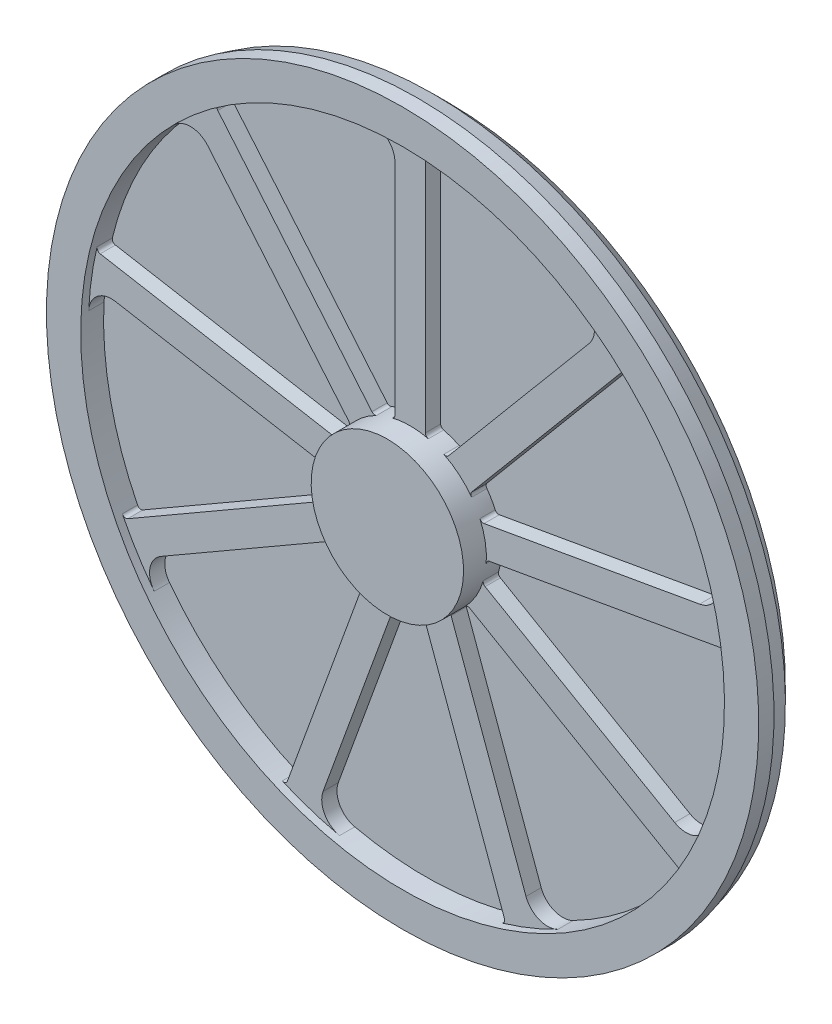
from build123d import *

# Parameters (mm, degrees)
BOSS_EXTRUDE2_DEPTH = 20


with BuildPart() as part:
    # Sketch1 → Revolve2 (revolve)
    with BuildSketch(Plane(origin=(0, 0, 0), x_dir=(0, 0, -1), z_dir=(1, 0, 0))):
        Polygon((-50, 0), (-50, 100), (0, 100), (0, 422.5), (-30, 422.5), (-30, 467.5), (-10, 467.5), (10.490381057, 462.009618943), (30, 442.5), (30, 0), align=None)
    revolve(axis=Axis((0, 0, -30), (0, 0, 1)))

    # Sketch2 → Boss-Extrude2 (add)
    with BuildSketch(Plane.XY):
        with BuildLine():
            ThreePointArc((20, 416.750824834), (21.571954346, 420.390674143), (25.299401198, 421.741852677))
            ThreePointArc((25.299401198, 421.741852677), (-14.324130925, 422.257112756), (-53.821656051, 419.057847248))
            ThreePointArc((-53.821656051, 419.057847248), (-30.183967117, 411.826133147), (-20, 389.302260461))
            Line((-20, 389.302260461), (-20, 101.980390272))
            ThreePointArc((-20, 101.980390272), (-21.066021038, 98.894323273), (-23.80952381, 97.124181211))
            ThreePointArc((-23.80952381, 97.124181211), (-7.6e-08, 100), (23.809523662, 97.124181247))
            ThreePointArc((23.809523662, 97.124181247), (21.066020991, 98.894323332), (20, 101.980390272))
            Line((20, 101.980390272), (20, 416.750824834))
        make_face()
        with BuildLine():
            Line((80.87262016, 65.265759081), (283.203155392, 306.393901336))
            ThreePointArc((283.203155392, 306.393901336), (286.746992321, 308.171754896), (290.470903088, 306.810861051))
            ThreePointArc((290.470903088, 306.810861051), (260.448719284, 332.675088673), (228.135411415, 355.612828872))
            ThreePointArc((228.135411415, 355.612828872), (241.594475451, 334.879000902), (234.917780585, 311.078585513))
            Line((234.917780585, 311.078585513), (50.230842435, 90.977263469))
            ThreePointArc((50.230842435, 90.977263469), (47.430537313, 89.298424107), (44.191066876, 89.705906207))
            ThreePointArc((44.191066876, 89.705906207), (64.278760914, 76.604444358), (80.669373607, 59.096972527))
            ThreePointArc((80.669373607, 59.096972527), (79.705554025, 62.216469562), (80.87262016, 65.265759081))
        make_face()
        with BuildLine():
            ThreePointArc((419.7278412, 48.319657717), (413.354719175, 87.430693327), (403.345384438, 125.772615671))
            ThreePointArc((403.345384438, 125.772615671), (400.328177931, 101.23826237), (379.914920814, 87.297783151))
            Line((379.914920814, 87.297783151), (96.958115442, 37.404863989))
            ThreePointArc((96.958115442, 37.404863989), (93.733820124, 37.918799861), (91.514166241, 40.313240718))
            ThreePointArc((91.514166241, 40.313240718), (97.855548193, 20.598341874), (100, 0))
            ThreePointArc((100, 0), (99.945767062, -3.292969231), (99.783127073, -6.582366715))
            ThreePointArc((99.783127073, -6.582366715), (101.049972403, -3.57316188), (103.904042548, -1.987446132))
            Line((103.904042548, -1.987446132), (413.892406924, 52.671866213))
            ThreePointArc((413.892406924, 52.671866213), (417.749925751, 51.755846586), (419.7278412, 48.319657717))
        make_face()
        with BuildLine():
            ThreePointArc((-252.561377668, 332.105405723), (-253.696840813, 335.904124837), (-251.709971685, 339.335144296))
            ThreePointArc((-251.709971685, 339.335144296), (-282.39456108, 314.260340916), (-310.59497249, 286.421041587))
            ThreePointArc((-310.59497249, 286.421041587), (-287.838996013, 296.075240754), (-265.55955831, 285.367081126))
            Line((-265.55955831, 285.367081126), (-80.87262016, 65.265759081))
            ThreePointArc((-80.87262016, 65.265759081), (-79.705554022, 62.216469491), (-80.669373691, 59.096972412))
            ThreePointArc((-80.669373691, 59.096972412), (-64.27876097, 76.604444311), (-44.191066878, 89.705906206))
            ThreePointArc((-44.191066878, 89.705906206), (-47.430537315, 89.298424108), (-50.230842435, 90.977263469))
            Line((-50.230842435, 90.977263469), (-252.561377668, 332.105405723))
        make_face()
        with BuildLine():
            ThreePointArc((-406.946479818, 92.064176334), (-410.25806463, 94.244302361), (-410.941451372, 98.149750609))
            ThreePointArc((-410.941451372, 98.149750609), (-418.329437639, 59.217662947), (-422.037449422, 19.764647353))
            ThreePointArc((-422.037449422, 19.764647353), (-410.8109597, 41.787452703), (-386.86084792, 47.90547303))
            Line((-386.86084792, 47.90547303), (-103.904042548, -1.987446132))
            ThreePointArc((-103.904042548, -1.987446132), (-101.049972452, -3.573161825), (-99.783127082, -6.582366568))
            ThreePointArc((-99.783127082, -6.582366568), (-98.480775309, 17.364817721), (-91.514166278, 40.313240634))
            ThreePointArc((-91.514166278, 40.313240634), (-93.733820164, 37.918799839), (-96.958115442, 37.404863989))
            Line((-96.958115442, 37.404863989), (-406.946479818, 92.064176334))
        make_face()
        with BuildLine():
            ThreePointArc((-370.916801355, -191.054904341), (-374.854980495, -191.513476599), (-377.888858856, -188.961002201))
            ThreePointArc((-377.888858856, -188.961002201), (-358.523321113, -223.533617647), (-336.003913346, -256.139845038))
            ThreePointArc((-336.003913346, -256.139845038), (-341.559909689, -232.053148883), (-327.14564731, -211.971638306))
            Line((-327.14564731, -211.971638306), (-78.317608663, -68.310703212))
            ThreePointArc((-78.317608663, -68.310703212), (-75.111985725, -67.690871012), (-72.207246346, -69.181743077))
            ThreePointArc((-72.207246346, -69.181743077), (-86.60254039, -49.999999979), (-96.016770169, -27.942438089))
            ThreePointArc((-96.016770169, -27.942438089), (-95.867649448, -28.63393708), (-95.817608663, -29.339560041))
            ThreePointArc((-95.817608663, -29.339560041), (-96.487481644, -31.839560041), (-98.317608663, -33.66968706))
            Line((-98.317608663, -33.66968706), (-370.916801355, -191.054904341))
        make_face()
        with BuildLine():
            ThreePointArc((-168.017869515, -387.654802013), (-130.960158095, -401.691034243), (-92.750411948, -412.193657258))
            ThreePointArc((-92.750411948, -412.193657258), (-112.489181919, -397.313503124), (-114.355362504, -372.664864277))
            Line((-114.355362504, -372.664864277), (-16.085495281, -102.67062307))
            ThreePointArc((-16.085495281, -102.67062307), (-14.028266101, -100.135269351), (-10.84479255, -99.41021313))
            ThreePointArc((-10.84479255, -99.41021313), (-34.202014712, -93.96926194), (-55.592060878, -83.123539189))
            ThreePointArc((-55.592060878, -83.123539189), (-53.961560514, -84.923661834), (-53.371663217, -87.27971662))
            ThreePointArc((-53.371663217, -87.27971662), (-53.447624452, -88.147957509), (-53.673200113, -88.989817337))
            Line((-53.673200113, -88.989817337), (-161.331029257, -384.777271937))
            ThreePointArc((-161.331029257, -384.777271937), (-164.053084938, -387.659971423), (-168.017869515, -387.654802013))
        make_face()
        with BuildLine():
            ThreePointArc((120.470548283, -404.96061166), (157.880718355, -391.892751619), (193.902038007, -375.377476225))
            ThreePointArc((193.902038007, -375.377476225), (169.21648425, -376.666453605), (151.943067336, -358.984058544))
            Line((151.943067336, -358.984058544), (53.673200113, -88.989817337))
            ThreePointArc((53.673200113, -88.989817337), (53.619435138, -85.725262282), (55.592060207, -83.123539638))
            ThreePointArc((55.592060207, -83.123539638), (34.202013938, -93.969262222), (10.844791714, -99.410213221))
            ThreePointArc((10.844791714, -99.410213221), (14.028265745, -100.135269129), (16.085495281, -102.67062307))
            Line((16.085495281, -102.67062307), (123.743324425, -398.45807767))
            ThreePointArc((123.743324425, -398.45807767), (123.511072308, -402.416057257), (120.470548283, -404.96061166))
        make_face()
        with BuildLine():
            ThreePointArc((352.589457658, -232.780850476), (372.847452038, -198.72349511), (389.825569397, -162.91800221))
            ThreePointArc((389.825569397, -162.91800221), (371.743876806, -179.772984263), (347.14564731, -177.330622155))
            Line((347.14564731, -177.330622155), (98.317608663, -33.66968706))
            ThreePointArc((98.317608663, -33.66968706), (96.178006763, -31.203452261), (96.016770156, -27.942438135))
            ThreePointArc((96.016770156, -27.942438135), (86.602540514, -49.999999765), (72.207246721, -69.181742686))
            ThreePointArc((72.207246721, -69.181742686), (75.111985993, -67.690870973), (78.317608663, -68.310703212))
            Line((78.317608663, -68.310703212), (350.916801355, -225.695920493))
            ThreePointArc((350.916801355, -225.695920493), (353.283026149, -228.877197545), (352.589457658, -232.780850476))
        make_face()
    extrude(amount=BOSS_EXTRUDE2_DEPTH)


solid = part.part
